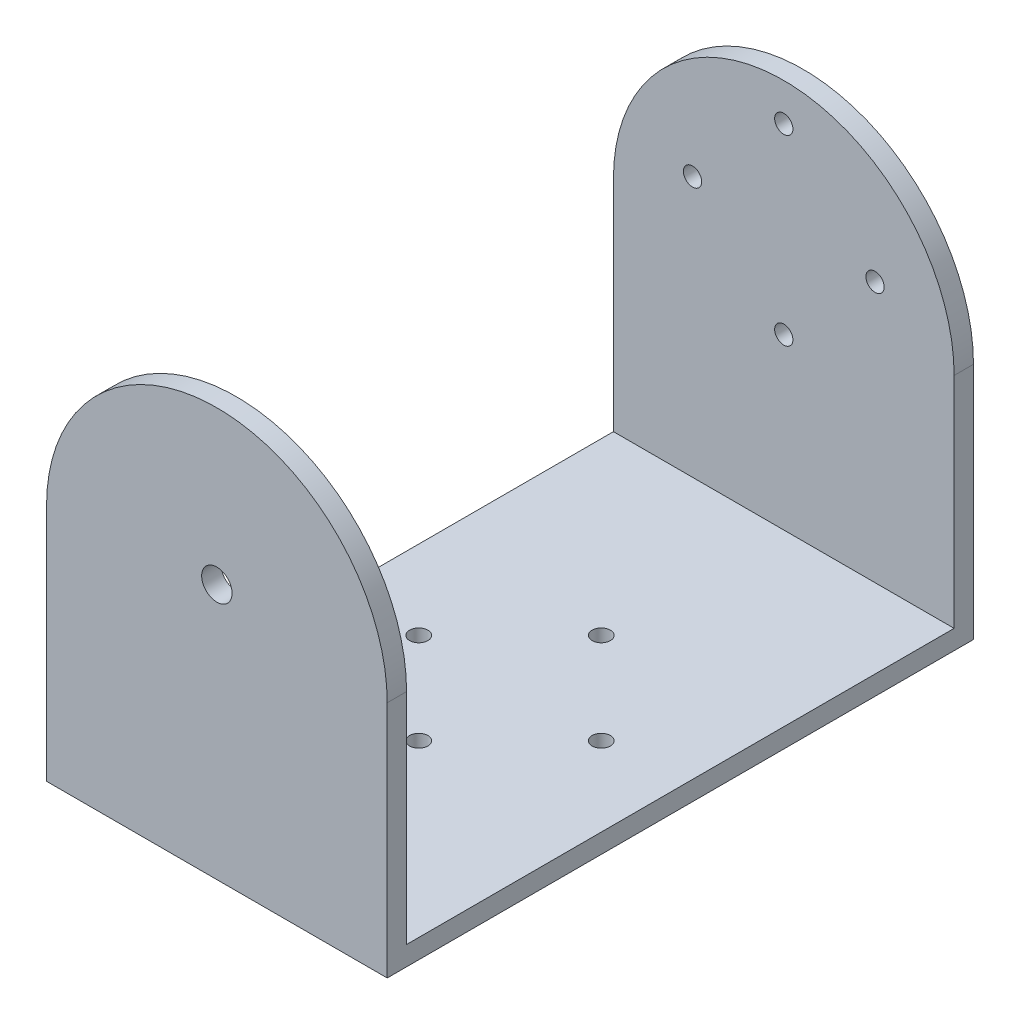
from build123d import *

# Parameters (mm, degrees)
SKETCH1_W           = 28
SKETCH1_H           = 48.18
SKETCH1_R           = 0.75
BOSS_EXTRUDE1_DEPTH = 1.59
SKETCH2_W           = 28
SKETCH2_H           = 1.59
BOSS_EXTRUDE2_DEPTH = 18
BOSS_EXTRUDE3_DEPTH = 1.59
BOSS_EXTRUDE4_START = -1.59
BOSS_EXTRUDE4_DEPTH = 1.59
SKETCH5_R           = 1.25
CUT_EXTRUDE1_DEPTH  = 6
SKETCH6_R           = 0.75
CUT_EXTRUDE2_DEPTH  = 6


with BuildPart() as part:
    # Sketch1 → Boss-Extrude1 (new body)
    with BuildSketch(Plane(origin=(0, 0, 0), x_dir=(1, 0, 0), z_dir=(0, 1, 0))):
        Rectangle(SKETCH1_W, SKETCH1_H)
        with Locations(Location((0, 7.5, 0), (0, 0, 90))):
            Circle(SKETCH1_R, mode=Mode.SUBTRACT)
        with Locations(Location((0, -7.5, 0), (0, 0, 90))):
            Circle(SKETCH1_R, mode=Mode.SUBTRACT)
        with Locations(Location((7.5, 0, 0), (0, 0, 90))):
            Circle(SKETCH1_R, mode=Mode.SUBTRACT)
        with Locations(Location((-7.5, 0, 0), (0, 0, 90))):
            Circle(SKETCH1_R, mode=Mode.SUBTRACT)
    extrude(amount=BOSS_EXTRUDE1_DEPTH)

    # Sketch2 → Boss-Extrude2 (add)
    with BuildSketch(Plane(origin=(0, 1.59, 0), x_dir=(1, 0, 0), z_dir=(0, 1, 0))):
        with Locations((0, 23.295)):
            Rectangle(SKETCH2_W, SKETCH2_H)
        with Locations((0, -23.295)):
            Rectangle(SKETCH2_W, SKETCH2_H)
    extrude(amount=BOSS_EXTRUDE2_DEPTH)

    # Sketch3 → Boss-Extrude3 (add)
    with BuildSketch(Plane.XY.offset(24.09)):
        with BuildLine():
            Line((-14, 19.59), (14, 19.59))
            ThreePointArc((14, 19.59), (0, 33.59), (-14, 19.59))
        make_face()
    extrude(amount=-BOSS_EXTRUDE3_DEPTH)

    # Sketch4 → Boss-Extrude4 (add)
    with BuildSketch(Plane(origin=(0, 0, -24.09), x_dir=(-1, 0, 0), z_dir=(0, 0, -1)).offset(BOSS_EXTRUDE4_START)):
        with BuildLine():
            Line((-14, 19.59), (14, 19.59))
            ThreePointArc((14, 19.59), (0, 33.59), (-14, 19.59))
        make_face()
    extrude(amount=BOSS_EXTRUDE4_DEPTH)

    # Sketch5 → Cut-Extrude1 (cut)
    with BuildSketch(Plane.XY.offset(24.09)):
        with Locations((0, 21)):
            Circle(SKETCH5_R)
    extrude(amount=-CUT_EXTRUDE1_DEPTH, mode=Mode.SUBTRACT)

    # Sketch6 → Cut-Extrude2 (cut)
    with BuildSketch(Plane(origin=(0, 0, -24.09), x_dir=(-1, 0, 0), z_dir=(0, 0, -1))):
        with Locations((0, 30.5)):
            Circle(SKETCH6_R)
        with Locations((0, 15.5)):
            Circle(SKETCH6_R)
        with Locations((7.5, 23)):
            Circle(SKETCH6_R)
        with Locations((-7.5, 23)):
            Circle(SKETCH6_R)
    extrude(amount=-CUT_EXTRUDE2_DEPTH, mode=Mode.SUBTRACT)


solid = part.part
